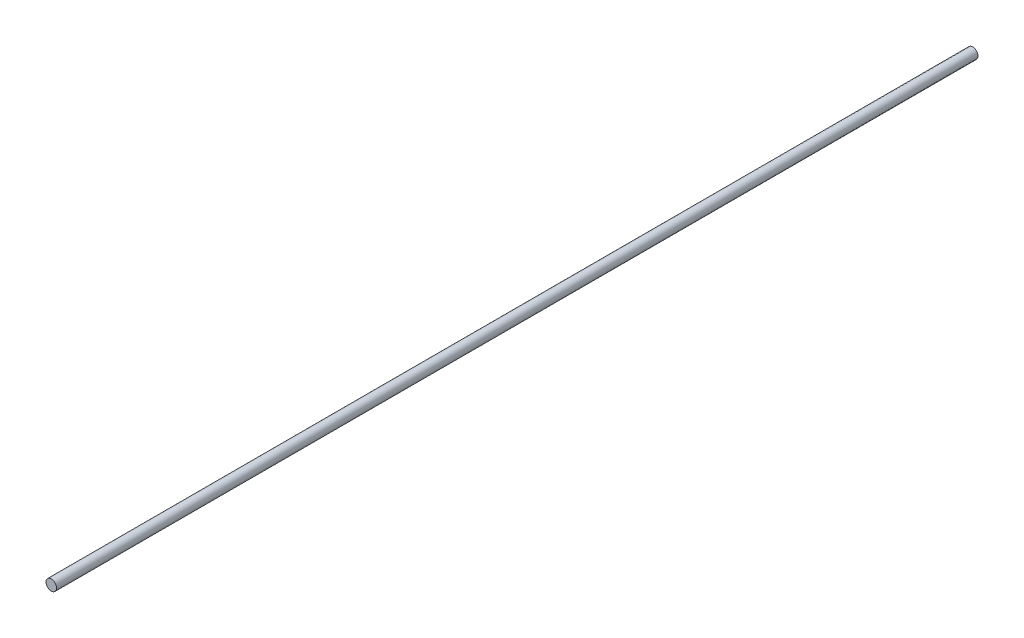
from build123d import *

# Parameters (mm, degrees)
CROQUIS1_R              = 4
SALIENTE_EXTRUIR1_DEPTH = 700


with BuildPart() as part:
    # Croquis1 → Saliente-Extruir1 (new body)
    with BuildSketch(Plane.XY):
        Circle(CROQUIS1_R)
    extrude(amount=SALIENTE_EXTRUIR1_DEPTH)


solid = part.part
